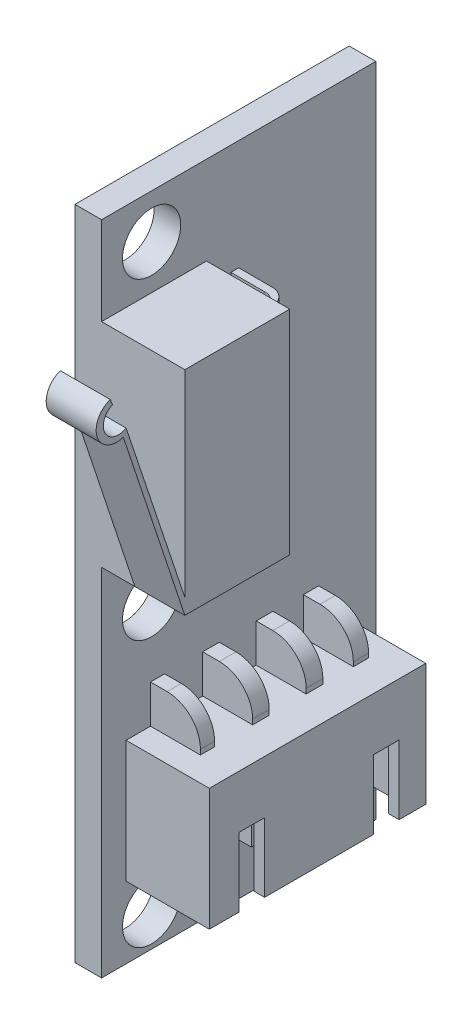
from build123d import *

# Parameters (mm, degrees)
SKETCH1_W           = 16.47
SKETCH1_H           = 39.44
BOSS_EXTRUDE1_DEPTH = 1.6
SKETCH2_W           = 6.3
SKETCH2_H           = 12.78
BOSS_EXTRUDE2_DEPTH = 5
SKETCH3_W           = 13
SKETCH3_H           = 7.33
BOSS_EXTRUDE3_DEPTH = 5
SKETCH4_W           = 0.849222168
SKETCH4_H           = 2.299281869
SKETCH4_W_2         = 0.996668432
SKETCH4_W_3         = 1.004572576
SKETCH4_W_4         = 0.915933819
SKETCH4_H_2         = 2.249002208
BOSS_EXTRUDE4_DEPTH = 3
SKETCH5_W           = 3.755878466
SKETCH5_H           = 11.665306642
CUT_EXTRUDE1_DEPTH  = 6
FILLET2_R           = 2
SKETCH6_W           = 1.024991321
SKETCH6_H           = 1.10945112
SKETCH6_H_2         = 1.02665626
SKETCH6_W_2         = 1.024991322
SKETCH6_H_3         = 1.059774204
SKETCH6_H_4         = 1.092892148
BOSS_EXTRUDE5_DEPTH = 5
SKETCH7_W           = 1.524548779
SKETCH7_H           = 4.1468753
CUT_EXTRUDE2_DEPTH  = 1
SKETCH8_W           = 1.935
SKETCH8_H           = 0.932620141
SKETCH8_H_2         = 0.892071439
SKETCH8_H_3         = 0.810974035
BOSS_EXTRUDE6_DEPTH = 3
FILLET3_R           = 1
CUT_EXTRUDE3_DEPTH  = 11
SKETCH10_R          = 1.75
CUT_EXTRUDE4_DEPTH  = 11
BOSS_EXTRUDE7_DEPTH = 3


with BuildPart() as part:
    # Sketch1 → Boss-Extrude1 (new body)
    with BuildSketch(Plane(origin=(0, 0, 0), x_dir=(0, 0, -1), z_dir=(1, 0, 0))):
        Rectangle(SKETCH1_W, SKETCH1_H)
    extrude(amount=BOSS_EXTRUDE1_DEPTH)

    # Sketch2 → Boss-Extrude2 (add)
    with BuildSketch(Plane(origin=(1.6, 0, 0), x_dir=(0, 0, -1), z_dir=(1, 0, 0))):
        with Locations((-5.085, 8.03)):
            Rectangle(SKETCH2_W, SKETCH2_H)
    extrude(amount=BOSS_EXTRUDE2_DEPTH)

    # Sketch3 → Boss-Extrude3 (add)
    with BuildSketch(Plane(origin=(1.6, 0, 0), x_dir=(0, 0, -1), z_dir=(1, 0, 0))):
        with Locations((-0.265, -11.755)):
            Rectangle(SKETCH3_W, SKETCH3_H)
    extrude(amount=BOSS_EXTRUDE3_DEPTH)

    # Sketch4 → Boss-Extrude4 (add)
    with BuildSketch(Plane(origin=(1.6, 0, 0), x_dir=(0, 0, -1), z_dir=(1, 0, 0))):
        with Locations((-4.874772316, -6.940359066)):
            Rectangle(SKETCH4_W, SKETCH4_H)
        with Locations((-1.665459639, -6.940359066)):
            Rectangle(SKETCH4_W_2, SKETCH4_H)
        with Locations((1.551129782, -6.940359066)):
            Rectangle(SKETCH4_W_3, SKETCH4_H)
        with Locations((4.343250619, -6.965498896)):
            Rectangle(SKETCH4_W_4, SKETCH4_H_2)
    extrude(amount=BOSS_EXTRUDE4_DEPTH)

    # Sketch5 → Cut-Extrude1 (cut)
    with BuildSketch(Plane(origin=(0, -15.42, 0), x_dir=(-1, 0, 0), z_dir=(0, -1, 0))):
        with Locations((-4.1, -0.265)):
            Rectangle(SKETCH5_W, SKETCH5_H)
    extrude(amount=-CUT_EXTRUDE1_DEPTH, mode=Mode.SUBTRACT)

    # Fillet2
    fillet2_edges = [part.edges().sort_by_distance(p)[0] for p in [
        (4.6, -5.790718131, 4.874772316),
        (4.6, -5.790718131, 1.665459639),
        (4.6, -5.790718131, -1.551129782),
        (4.6, -5.840997792, -4.343250618),
    ]]
    fillet(fillet2_edges, radius=FILLET2_R)

    # Sketch6 → Boss-Extrude5 (add)
    with BuildSketch(Plane(origin=(0, -9.42, 0), x_dir=(-1, 0, 0), z_dir=(0, -1, 0))):
        with Locations((-4.084273497, -4.083852883)):
            Rectangle(SKETCH6_W, SKETCH6_H)
        with Locations((-4.084273497, -1.715919896)):
            Rectangle(SKETCH6_W, SKETCH6_H_2)
        with Locations((-4.1, 1.14878225)):
            Rectangle(SKETCH6_W_2, SKETCH6_H_3)
        with Locations((-4.1, 3.467038322)):
            Rectangle(SKETCH6_W_2, SKETCH6_H_4)
    extrude(amount=BOSS_EXTRUDE5_DEPTH)

    # Sketch7 → Cut-Extrude2 (cut)
    with BuildSketch(Plane(origin=(6.6, 0, 0), x_dir=(0, 0, -1), z_dir=(1, 0, 0))):
        with Locations((-4.207178808, -13.34656235)):
            Rectangle(SKETCH7_W, SKETCH7_H)
        with Locations((3.868809321, -13.34656235)):
            Rectangle(SKETCH7_W, SKETCH7_H)
    extrude(amount=-CUT_EXTRUDE2_DEPTH, mode=Mode.SUBTRACT)

    # Sketch8 → Boss-Extrude6 (add)
    with BuildSketch(Plane(origin=(1.6, 0, 0), x_dir=(0, 0, -1), z_dir=(1, 0, 0))):
        with Locations((-0.9675, 12.634426175)):
            Rectangle(SKETCH8_W, SKETCH8_H)
        with Locations((-0.9675, 7.91050242)):
            Rectangle(SKETCH8_W, SKETCH8_H_2)
        with Locations((-0.9675, 2.8824634)):
            Rectangle(SKETCH8_W, SKETCH8_H_3)
    extrude(amount=BOSS_EXTRUDE6_DEPTH)

    # Fillet3
    fillet3_edges = [part.edges().sort_by_distance(p)[0] for p in [
        (4.6, 12.634426176, 0),
        (4.6, 7.910502419, 0),
        (4.6, 2.8824634, 0),
    ]]
    fillet(fillet3_edges, radius=FILLET3_R)

    # Sketch9 → Cut-Extrude3 (cut)
    with BuildSketch(Plane(origin=(0, 13.100736246, 0), x_dir=(1, 0, 0), z_dir=(0, 1, 0))):
        with BuildLine():
            Line((1.6, -0.469848577), (3.597144342, -0.469848577))
            add(Edge.make_bspline(
                [(3.597144342, -0.469848577), (4.148845696, -0.430996369), (4.233002481, -0.792491938), (4.243645389, -1.010671568)],
                knots=[0, 0, 0, 0, 1, 1, 1, 1], degree=3))
            Line((4.243645389, -1.010671568), (4.243645389, -1.935))
            Line((4.243645389, -1.935), (1.6, -1.935))
            Line((1.6, -1.935), (1.6, -0.469848577))
        make_face()
    extrude(amount=-CUT_EXTRUDE3_DEPTH, mode=Mode.SUBTRACT)

    # Sketch10 → Cut-Extrude4 (cut)
    with BuildSketch(Plane(origin=(1.6, 0, 0), x_dir=(0, 0, -1), z_dir=(1, 0, 0))):
        with Locations((-5.232585415, -1.723827663)):
            Circle(SKETCH10_R)
        with Locations((-5.232585415, 17.072870227)):
            Circle(SKETCH10_R)
        with Locations((-5.232585415, -17.69434278)):
            Circle(SKETCH10_R)
        with Locations((4.936201482, -17.69434278)):
            Circle(SKETCH10_R)
    extrude(amount=-CUT_EXTRUDE4_DEPTH, mode=Mode.SUBTRACT)

    # Sketch11 → Boss-Extrude7 (add)
    with BuildSketch(Plane(origin=(6.6, 0, 0), x_dir=(0, 0, -1), z_dir=(1, 0, 0))):
        with BuildLine():
            Line((-8.235, 1.64), (-11.930418499, 12.753922868))
            ThreePointArc((-11.930418499, 12.753922868), (-13.49815489, 13.539255516), (-12.712822243, 15.106991908))
            Line((-12.712822243, 15.106991908), (-12.58261695, 14.771125615))
            ThreePointArc((-12.58261695, 14.771125615), (-13.033453184, 13.523901114), (-11.761958985, 13.146906726))
            Line((-11.761958985, 13.146906726), (-8.235, 2.583341722))
            Line((-8.235, 2.583341722), (-8.235, 1.64))
        make_face()
    extrude(amount=-BOSS_EXTRUDE7_DEPTH)


solid = part.part
